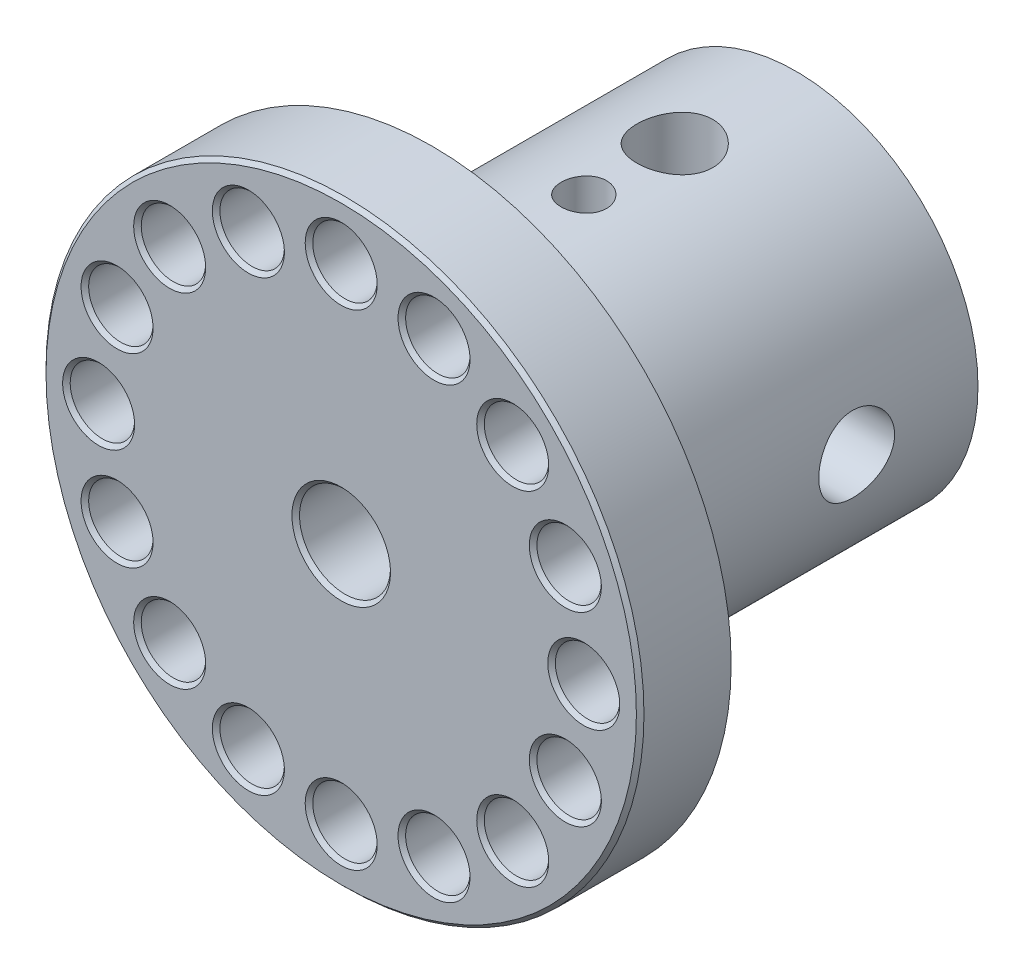
from build123d import *

# Parameters (mm, degrees)
SKETCH2_R               = 3.3734375
CUT_EXTRUDE1_DEPTH      = 66.024682125
CIRPATTERN1_COUNT       = 16
SKETCH4_R               = 2.38125
CUT_EXTRUDE2_DEPTH      = 66.024682125
CUT_EXTRUDE3_REACH      = 67.025
CUT_EXTRUDE3_END_RADIUS = 2.38125
SKETCH5_R               = 3.96875
CUT_EXTRUDE4_DEPTH      = 66.024682199
CIRPATTERN2_COUNT       = 2
CIRPATTERN2_ANGLE       = 90
CHAMFER1_SIZE           = 0.396875


with BuildPart() as part:
    # Sketch1 → Base-Revolve (revolve)
    with BuildSketch(Plane(origin=(0, 0, 0), x_dir=(0, 0, -1), z_dir=(1, 0, 0)), mode=Mode.PRIVATE) as base_revolve_sk:
        with BuildLine():
            Line((0, 31.3055), (0, 4.7625))
            Line((0, 4.7625), (19.05, 4.7625))
            Line((19.05, 4.7625), (19.05, 3.96875))
            Line((19.05, 3.96875), (25.4, 3.96875))
            Line((25.4, 3.96875), (25.4, 6.35))
            Line((25.4, 6.35), (47.625, 6.35))
            Line((47.625, 6.35), (47.625, 19.05))
            Line((47.625, 19.05), (12.7, 19.05))
            ThreePointArc((12.7, 19.05), (10.45493597, 19.97993597), (9.525, 22.225))
            Line((9.525, 22.225), (9.525, 31.3055))
            Line((9.525, 31.3055), (0, 31.3055))
        make_face()
    revolve(base_revolve_sk.sketch.rotate(Axis((0, 0, 8.5328125), (0, 0, -1)), 90), axis=Axis((0, 0, 8.5328125), (0, 0, -1)))

    # Sketch2 → Cut-Extrude1 (cut, through all)
    with BuildSketch(Plane.XY):
        with Locations((25.4, 0)):
            Circle(SKETCH2_R)
    cut_extrude1 = extrude(amount=-CUT_EXTRUDE1_DEPTH, mode=Mode.SUBTRACT)

    # CirPattern1: Cut-Extrude1 ×16 about axis
    cirpattern1_axis = Axis((0, 0, 0), (0, 0, 1))
    for i in range(1, CIRPATTERN1_COUNT):
        add(cut_extrude1.rotate(cirpattern1_axis, i * 360 / CIRPATTERN1_COUNT), mode=Mode.SUBTRACT)

    # Sketch4 → Cut-Extrude2 (cut, through all)
    with BuildSketch(Plane(origin=(0, 0, 0), x_dir=(1, 0, 0), z_dir=(0, 1, 0))):
        with Locations(Location((0, 25.4, 0), (0, 0, 90))):
            Circle(SKETCH4_R)
    extrude(amount=CUT_EXTRUDE2_DEPTH, mode=Mode.SUBTRACT)

    # Cut-Extrude3: up to this cylinder (the profile starts outside it)
    cut_extrude3_end = Plane(origin=(0, 7.109273, -25.4), z_dir=(0, -1, 0)) * Cylinder(CUT_EXTRUDE3_END_RADIUS, 139.8125, mode=Mode.PRIVATE)
    # Sketch3 → Cut-Extrude3 (cut, up to the surface)
    with BuildSketch(Plane(origin=(0, 0, -47.625), x_dir=(-1, 0, 0), z_dir=(0, 0, -1)), mode=Mode.PRIVATE) as cut_extrude3_sk1:
        with BuildLine():
            Line((-1.5875, 7.9375), (1.5875, 7.9375))
            Line((1.5875, 7.9375), (1.5875, 6.148361062))
            ThreePointArc((1.5875, 6.148361062), (0, 6.35), (-1.5875, 6.148361062))
            Line((-1.5875, 6.148361062), (-1.5875, 7.9375))
        make_face()
    cut_extrude3_tool1 = extrude(cut_extrude3_sk1.sketch, amount=-CUT_EXTRUDE3_REACH, mode=Mode.PRIVATE) - cut_extrude3_end
    add(cut_extrude3_tool1.solids().sort_by_distance((0, 7.109273, -47.625))[0], mode=Mode.SUBTRACT)

    # Sketch5 → Cut-Extrude4 (cut, through all)
    with BuildSketch(Plane(origin=(0, 0, 0), x_dir=(1, 0, 0), z_dir=(0, 1, 0))):
        with Locations(Location((0, 34.925, 0), (0, 0, 90))):
            Circle(SKETCH5_R)
    cut_extrude4 = extrude(amount=CUT_EXTRUDE4_DEPTH, mode=Mode.SUBTRACT)

    # CirPattern2: Cut-Extrude4 ×2 about axis
    cirpattern2_axis = Axis((0, 0, -41.4671875), (0, 0, -1))
    for i in range(1, CIRPATTERN2_COUNT):
        add(cut_extrude4.rotate(cirpattern2_axis, i * CIRPATTERN2_ANGLE / (CIRPATTERN2_COUNT - 1)), mode=Mode.SUBTRACT)

    # Chamfer1
    chamfer1_edges = [part.edges().sort_by_distance(p)[0] for p in [
        (8.429200541, -20.349890265, 0),
        (15.57513171, -15.57513171, 0),
        (-4.7625, 0, 0),
        (-31.3055, 0, 0),
        (20.349890265, -8.429200541, 0),
        (22.0265625, 0, 0),
        (20.349890265, 8.429200541, 0),
        (15.57513171, 15.57513171, 0),
        (8.429200541, 20.349890265, 0),
        (0, 22.0265625, 0),
        (-8.429200541, 20.349890265, 0),
        (-15.57513171, 15.57513171, 0),
        (-20.349890265, 8.429200541, 0),
        (-22.0265625, 0, 0),
        (-20.349890265, -8.429200541, 0),
        (-15.57513171, -15.57513171, 0),
        (-8.429200541, -20.349890265, 0),
        (0, -22.0265625, 0),
    ]]
    chamfer(chamfer1_edges, length=CHAMFER1_SIZE)


solid = part.part
